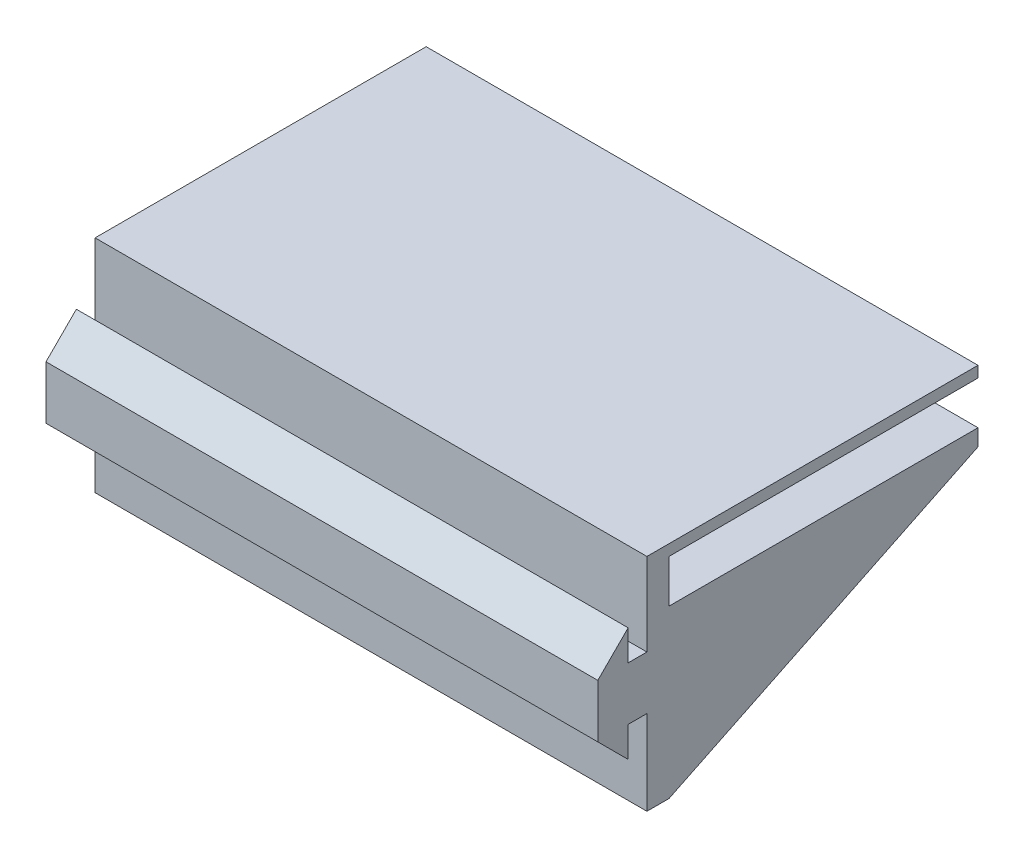
from build123d import *

# Parameters (mm, degrees)
BOSS_EXTRUDE2_DEPTH  = 50
BOSS_EXTRUDE10_DEPTH = 1.5
BOSS_EXTRUDE11_DEPTH = 1.5


with BuildPart() as part:
    # Sketch1 → Boss-Extrude2 (new body)
    with BuildSketch(Plane(origin=(0, 0, 0), x_dir=(0, 0, -1), z_dir=(1, 0, 0))):
        Polygon((0, 7.671680622), (0, 0), (2, 0), (2, 13.6), (30, 13.6), (30, 15.1), (2, 15.1), (2, 19), (30, 19), (30, 20), (0, 20), (0, 12.5), (-1.7, 12.5), (-1.7, 15.25), (-4.45, 12.5), (-4.45, 7.671680622), (-1.7, 4.921680622), (-1.7, 7.671680622), align=None)
    extrude(amount=BOSS_EXTRUDE2_DEPTH)

    # Sketch1<13> → Boss-Extrude10 (add)
    with BuildSketch(Plane(origin=(0, 0, 0), x_dir=(0, 0, -1), z_dir=(1, 0, 0))):
        Polygon((2, 13.6), (2, 0), (30, 13.6), align=None)
    extrude(amount=BOSS_EXTRUDE10_DEPTH)

    # Sketch7 → Boss-Extrude11 (add)
    with BuildSketch(Plane(origin=(50, 0, 0), x_dir=(0, 0, -1), z_dir=(1, 0, 0))):
        Polygon((2, 13.6), (2, 0), (30, 13.6), align=None)
    extrude(amount=-BOSS_EXTRUDE11_DEPTH)


solid = part.part
